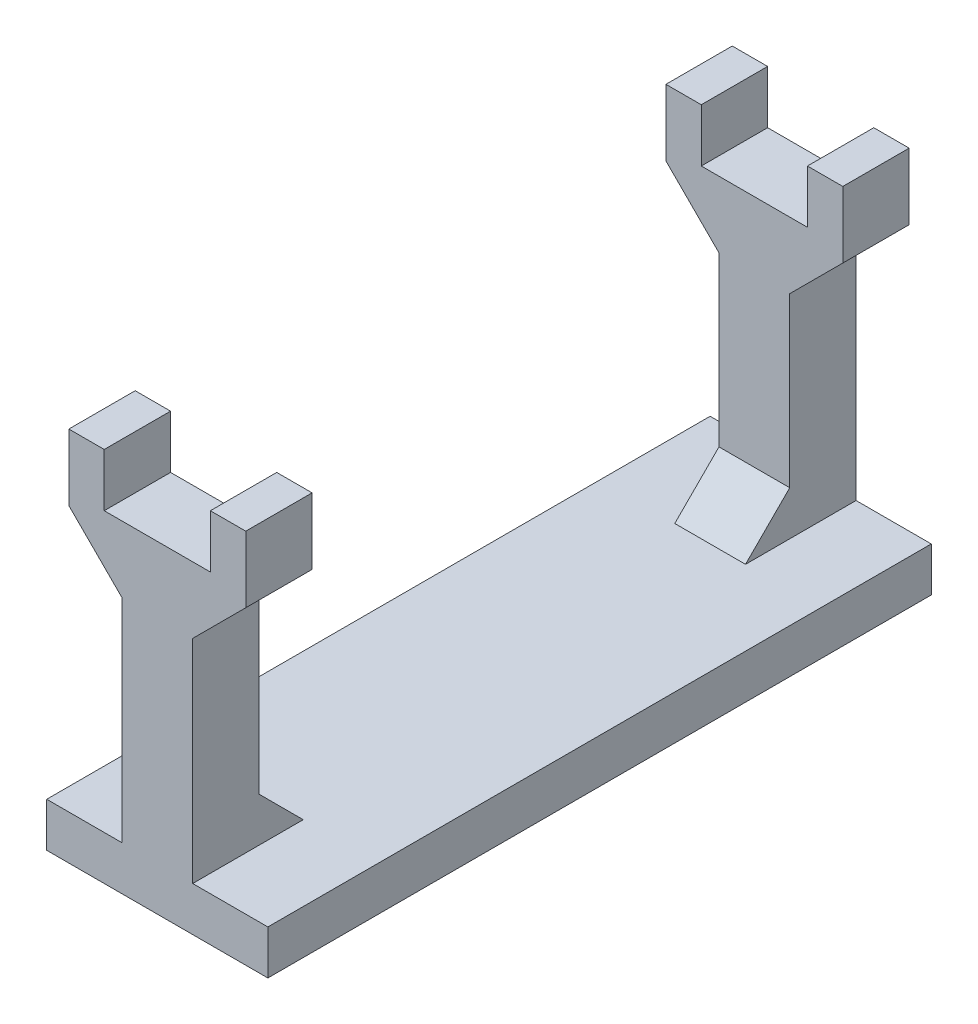
from build123d import *

# Parameters (mm, degrees)
EXTRUDE_2_DEPTH     = 150
CUT_EXTRUDE_2_DEPTH = 180.51323071


with BuildPart() as part:
    # 草图3 → 凸台-拉伸2 (new body)
    with BuildSketch(Plane.XY):
        Polygon((0, 0), (0, 10), (17, 10), (17, 58), (5, 70), (5, 85), (13, 85), (13, 73), (37, 73), (37, 85), (45, 85), (45, 70), (33, 58), (33, 10), (50, 10), (50, 0), align=None)
    extrude(amount=EXTRUDE_2_DEPTH)

    # 草图4 → 切除-拉伸2 (cut, through all)
    with BuildSketch(Plane(origin=(50, 0, 0), x_dir=(0, 0, -1), z_dir=(1, 0, 0))):
        Polygon((-135, 85), (-135, 20), (-125, 10), (-25, 10), (-15, 20), (-15, 85), align=None)
    extrude(amount=-CUT_EXTRUDE_2_DEPTH, mode=Mode.SUBTRACT)


solid = part.part
